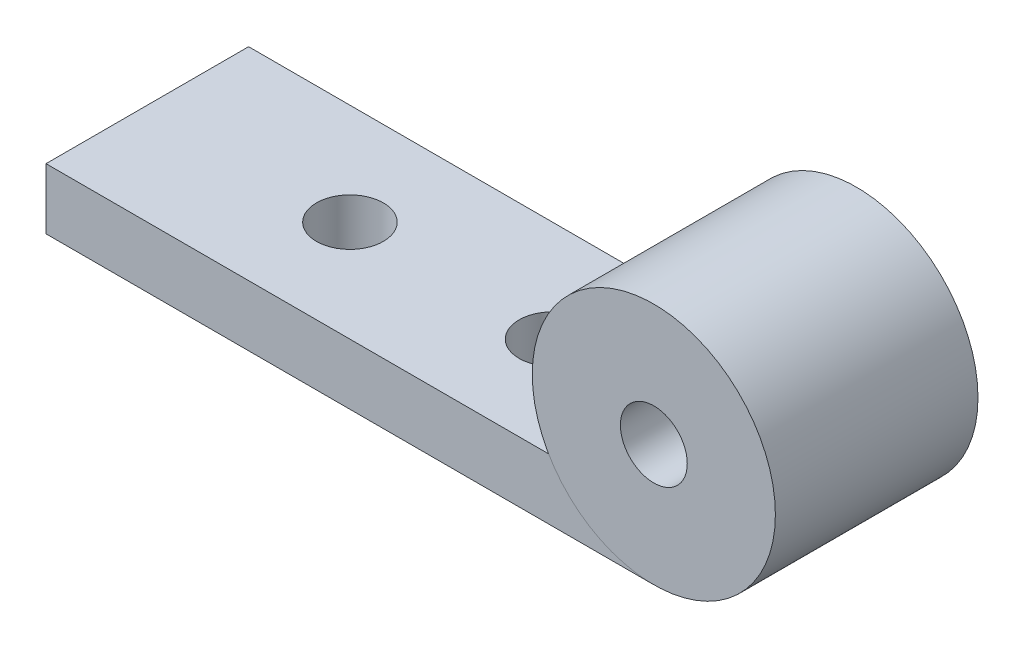
from build123d import *

# Parameters (mm, degrees)
SKETCH_1_W      = 30
SKETCH_1_H      = 10
SKETCH_1_R      = 1.65
EXTRUDE_1_DEPTH = 3
SKETCH_2_R      = 6
SKETCH_2_R_2    = 1.65
EXTRUDE_2_DEPTH = 10


with BuildPart() as part:
    # 草图1 → 凸台-拉伸1 (new body)
    with BuildSketch(Plane(origin=(0, 0, 0), x_dir=(1, 0, 0), z_dir=(0, 1, 0))):
        Rectangle(SKETCH_1_W, SKETCH_1_H)
        with Locations(Location((-5, 0, 0), (0, 0, 270))):
            Circle(SKETCH_1_R, mode=Mode.SUBTRACT)
        with Locations(Location((5, 0, 0), (0, 0, 270))):
            Circle(SKETCH_1_R, mode=Mode.SUBTRACT)
    extrude(amount=EXTRUDE_1_DEPTH)


with BuildPart() as body_2:
    # 草图2 → 凸台-拉伸2 (new body)
    with BuildSketch(Plane.XY.offset(5)):
        with Locations((15, 6)):
            Circle(SKETCH_2_R)
        with Locations((15, 6)):
            Circle(SKETCH_2_R_2, mode=Mode.SUBTRACT)
    extrude(amount=-EXTRUDE_2_DEPTH)


solid = Compound([part.part, body_2.part])
